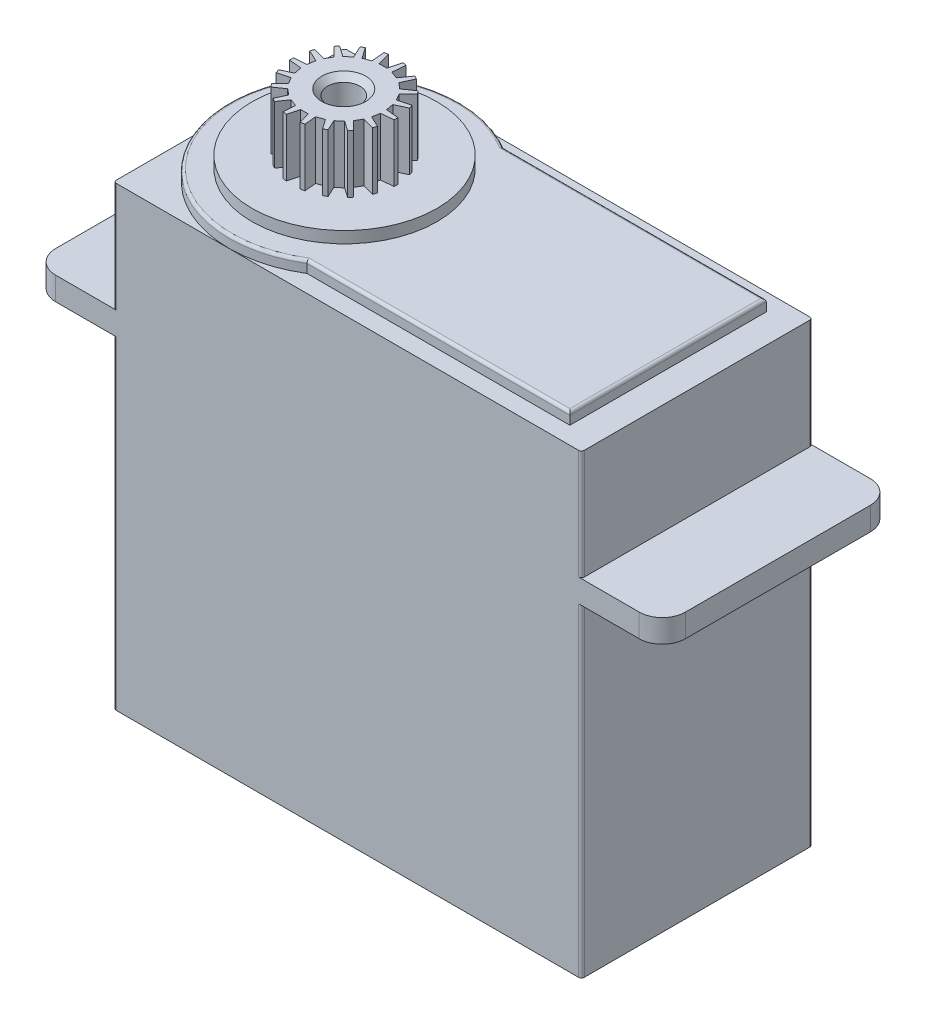
from build123d import *

# Parameters (mm, degrees)
ESQUISSE1_W                  = 40.5
ESQUISSE1_H                  = 39.5
BOSS_EXTRU_1_DEPTH           = 20
ESQUISSE2_W                  = 20
ESQUISSE2_H                  = 2
BOSS_EXTRU_2_DEPTH           = 7
ESQUISSE3_W                  = 20
ESQUISSE3_H                  = 2
BOSS_EXTRU_3_DEPTH           = 7
CONG_1_R                     = 2
BOSS_EXTRU_4_DEPTH           = 1
ESQUISSE6_R                  = 8
BOSS_EXTRU_5_DEPTH           = 1
ESQUISSE7_R                  = 4.5
BOSS_EXTRU_6_DEPTH           = 5
ENL_V_START                  = -5
ENL_V_MAT_EXTRU_2_DEPTH      = 5
R_P_TITION_CIRCULAIRE2_COUNT = 18
ESQUISSE9_R                  = 1.4
ENL_V_MAT_EXTRU_3_DEPTH      = 5
CHANFREIN1_SIZE              = 0.5
CONG_3_R                     = 0.25
CONG_4_R                     = 0.25


with BuildPart() as part:
    # Esquisse1 → Boss.-Extru.1 (new body)
    with BuildSketch(Plane.XY):
        Rectangle(ESQUISSE1_W, ESQUISSE1_H)
    extrude(amount=BOSS_EXTRU_1_DEPTH)

    # Esquisse2 → Boss.-Extru.2 (add)
    with BuildSketch(Plane.ZY.offset(20.25)):
        with Locations((10, 9.25)):
            Rectangle(ESQUISSE2_W, ESQUISSE2_H)
    extrude(amount=BOSS_EXTRU_2_DEPTH)

    # Esquisse3 → Boss.-Extru.3 (add)
    with BuildSketch(Plane(origin=(20.25, 0, 0), x_dir=(0, 0, -1), z_dir=(1, 0, 0))):
        with Locations((-10, 9.25)):
            Rectangle(ESQUISSE3_W, ESQUISSE3_H)
    extrude(amount=BOSS_EXTRU_3_DEPTH)

    # Congé1
    cong_1_edges = [part.edges().sort_by_distance(p)[0] for p in [
        (-27.25, 9.25, 0),
        (-27.25, 9.25, 20),
        (27.25, 9.25, 20),
        (27.25, 9.25, 0),
    ]]
    fillet(cong_1_edges, radius=CONG_1_R)

    # Esquisse4 → Boss.-Extru.4 (add)
    with BuildSketch(Plane(origin=(0, 19.75, 0), x_dir=(1, 0, 0), z_dir=(0, 1, 0))):
        with BuildLine():
            Line((17.75, -1.5), (17.75, -18.5))
            Line((17.75, -18.5), (-5.001587186, -18.5))
            ThreePointArc((-5.001587186, -18.5), (-20.239786638, -10), (-5.001587186, -1.5))
            Line((-5.001587186, -1.5), (17.75, -1.5))
        make_face()
    extrude(amount=BOSS_EXTRU_4_DEPTH)

    # Esquisse6 → Boss.-Extru.5 (add)
    with BuildSketch(Plane(origin=(0, 20.75, 0), x_dir=(1, 0, 0), z_dir=(0, 1, 0))):
        with Locations(Location((-10.25, -10, 0), (0, 0, 270))):
            Circle(ESQUISSE6_R)
    extrude(amount=BOSS_EXTRU_5_DEPTH)

    # Esquisse7 → Boss.-Extru.6 (add)
    with BuildSketch(Plane(origin=(0, 21.75, 0), x_dir=(1, 0, 0), z_dir=(0, 1, 0))):
        with Locations(Location((-10.25, -10, 0), (0, 0, 270))):
            Circle(ESQUISSE7_R)
    extrude(amount=BOSS_EXTRU_6_DEPTH)

    # Esquisse8 → Enlèv. mat.-Extru.2 (cut)
    with BuildSketch(Plane(origin=(0, 26.75, 0), x_dir=(1, 0, 0), z_dir=(0, 1, 0)).offset(ENL_V_START)):
        with BuildLine():
            Line((-10.606352849, -6.656584169), (-10.903477232, -5.547700874))
            ThreePointArc((-10.903477232, -5.547700874), (-10.272597671, -5.50005674), (-9.641271425, -5.541362369))
            Line((-9.641271425, -5.541362369), (-9.940094206, -6.656584169))
            Line((-9.940094206, -6.656584169), (-10.606352849, -6.656584169))
        make_face()
    enl_v_mat_extru_2 = extrude(amount=ENL_V_MAT_EXTRU_2_DEPTH, mode=Mode.SUBTRACT)

    # Répétition circulaire2: Enlèv. mat.-Extru.2 ×18 about axis
    r_p_tition_circulaire2_axis = Axis((-10.249601616, 0, 10.07055578), (0, 1, 0))
    for i in range(1, R_P_TITION_CIRCULAIRE2_COUNT):
        add(enl_v_mat_extru_2.rotate(r_p_tition_circulaire2_axis, i * 360 / R_P_TITION_CIRCULAIRE2_COUNT), mode=Mode.SUBTRACT)

    # Esquisse9 → Enlèv. mat.-Extru.3 (cut)
    with BuildSketch(Plane(origin=(0, 26.75, 0), x_dir=(1, 0, 0), z_dir=(0, 1, 0))):
        with Locations(Location((-10.249601616, -10.07055578, 0), (0, 0, 270))):
            Circle(ESQUISSE9_R)
    extrude(amount=-ENL_V_MAT_EXTRU_3_DEPTH, mode=Mode.SUBTRACT)

    # Chanfrein1
    chanfrein1_edges = [part.edges().sort_by_distance(p)[0] for p in [
        (-10.249601616, 26.75, 8.67055578),
    ]]
    chamfer(chanfrein1_edges, length=CHANFREIN1_SIZE)

    # Congé3
    cong_3_edges = [part.edges().sort_by_distance(p)[0] for p in [
        (6.374206407, 20.75, 1.5),
        (-20.239786638, 20.75, 10),
        (6.374206407, 20.75, 18.5),
        (17.75, 20.75, 10),
    ]]
    fillet(cong_3_edges, radius=CONG_3_R)

    # Congé4
    cong_4_edges = [part.edges().sort_by_distance(p)[0] for p in [
        (-20.25, 15, 20),
        (-20.25, -5.75, 0),
        (-20.25, -5.75, 20),
        (20.25, 15, 0),
        (20.25, 15, 20),
        (20.25, -5.75, 20),
        (-20.25, 15, 0),
        (20.25, -5.75, 0),
    ]]
    fillet(cong_4_edges, radius=CONG_4_R)


solid = part.part
